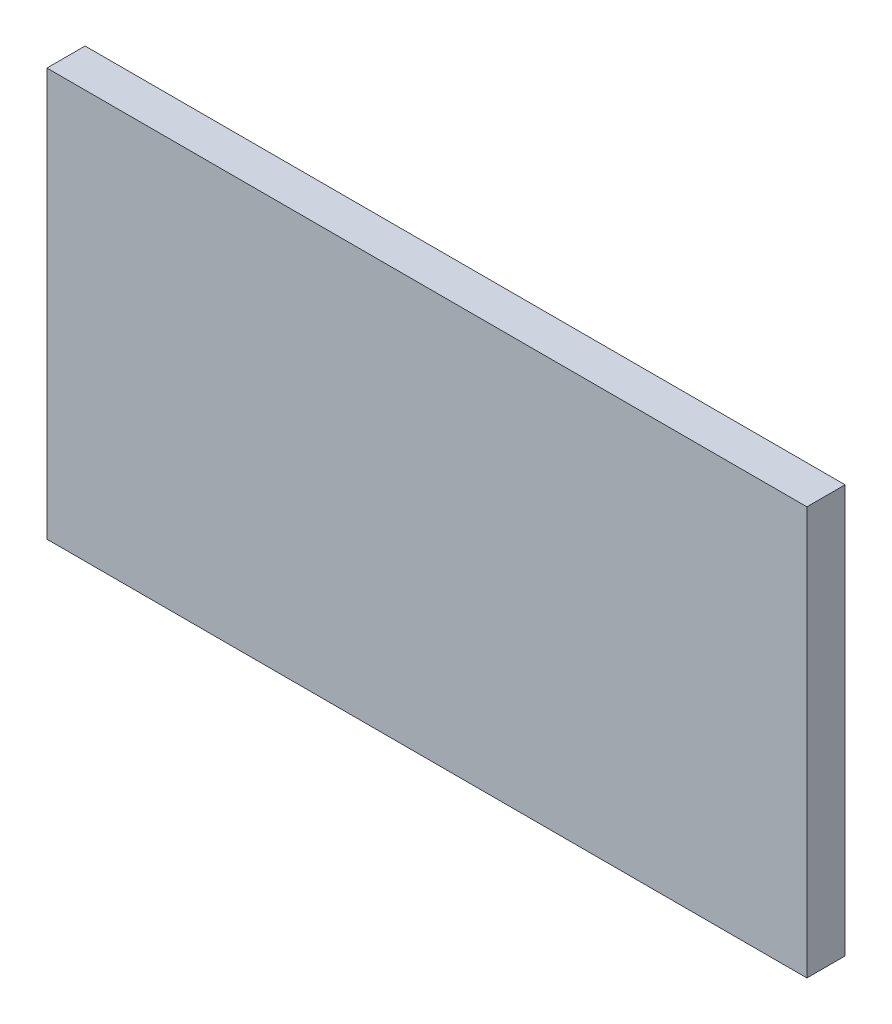
from build123d import *

# Parameters (mm, degrees)
SKETCH1_W           = 59.744844877
SKETCH1_H           = 32.077769062
BOSS_EXTRUDE1_DEPTH = 3


with BuildPart() as part:
    # Sketch1 → Boss-Extrude1 (new body)
    with BuildSketch(Plane.XY):
        with Locations((3.00729085, -2.205346623)):
            Rectangle(SKETCH1_W, SKETCH1_H)
    extrude(amount=BOSS_EXTRUDE1_DEPTH)


solid = part.part
